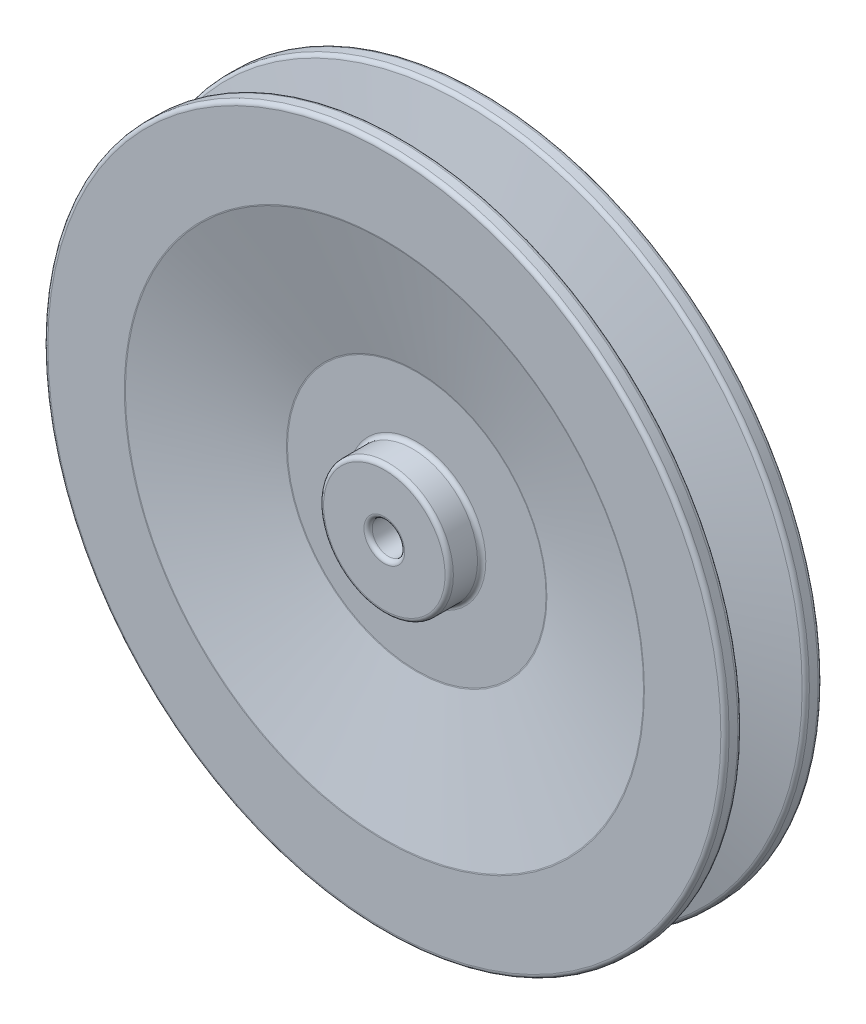
from build123d import *

# Parameters (mm, degrees)
FILLET3_R = 0.8128


with BuildPart() as part:
    # Sketch1 → Revolve8 (revolve)
    with BuildSketch(Plane(origin=(0, 0, 0), x_dir=(1, 0, 0), z_dir=(0, 1, 0))):
        Polygon((3.175, 19.05), (3.175, 0), (12.7, 0), (12.7, 6.35), (25.4, 6.35), (50.8, 0), (66.675, 0), (66.675, 3.175), (50.8, 6.902747475), (50.8, 12.147252525), (66.675, 15.875), (66.675, 19.05), (50.8, 19.05), (25.4, 12.7), (12.7, 12.7), (12.7, 19.05), align=None)
    revolve(axis=Axis((0, 0, 0), (0, 0, -1)))

    # Fillet3
    fillet3_edges = [part.edges().sort_by_distance(p)[0] for p in [
        (-50.8, 0, -19.05),
        (-66.675, 0, -19.05),
        (-66.675, 0, -15.875),
        (-50.8, 0, -12.147252525),
        (-50.8, 0, -6.902747475),
        (-66.675, 0, -3.175),
        (-66.675, 0, 0),
        (-50.8, 0, 0),
        (-25.4, 0, -6.35),
        (-12.7, 0, -6.35),
        (-12.7, 0, 0),
        (-3.175, 0, 0),
        (-3.175, 0, -19.05),
        (-12.7, 0, -19.05),
        (-12.7, 0, -12.7),
        (-25.4, 0, -12.7),
    ]]
    fillet(fillet3_edges, radius=FILLET3_R)


solid = part.part
